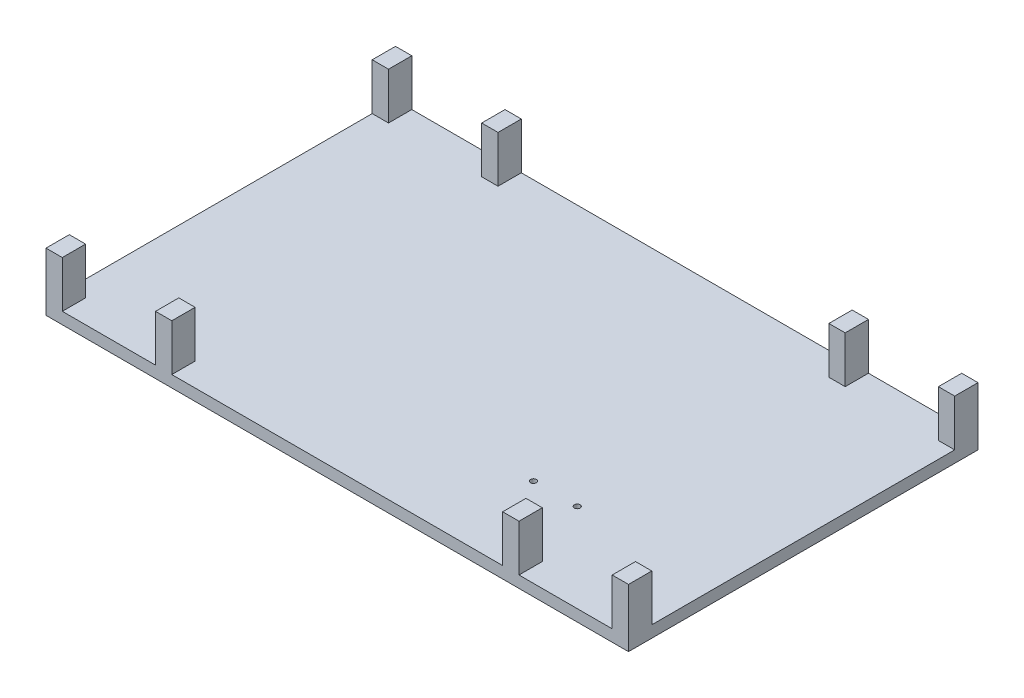
from build123d import *

# Parameters (mm, degrees)
SKETCH1_W           = 250
SKETCH1_H           = 150
BOSS_EXTRUDE1_DEPTH = 5
SKETCH2_W           = 7
SKETCH2_H           = 10
BOSS_EXTRUDE2_DEPTH = 20
SKETCH3_R           = 1.25
CUT_EXTRUDE1_DEPTH  = 148.139389696


with BuildPart() as part:
    # Sketch1 → Boss-Extrude1 (new body)
    with BuildSketch(Plane(origin=(0, 0, 0), x_dir=(1, 0, 0), z_dir=(0, 1, 0))):
        Rectangle(SKETCH1_W, SKETCH1_H)
    extrude(amount=BOSS_EXTRUDE1_DEPTH)

    # Sketch2 → Boss-Extrude2 (add)
    with BuildSketch(Plane(origin=(0, 5, 0), x_dir=(1, 0, 0), z_dir=(0, 1, 0))):
        with Locations((-121.5, -70)):
            Rectangle(SKETCH2_W, SKETCH2_H)
        with Locations((-74.5, -70)):
            Rectangle(SKETCH2_W, SKETCH2_H)
        with Locations((-121.5, 70)):
            Rectangle(SKETCH2_W, SKETCH2_H)
        with Locations((-74.5, 70)):
            Rectangle(SKETCH2_W, SKETCH2_H)
        with Locations((121.5, 70)):
            Rectangle(SKETCH2_W, SKETCH2_H)
        with Locations((74.5, 70)):
            Rectangle(SKETCH2_W, SKETCH2_H)
        with Locations((121.5, -70)):
            Rectangle(SKETCH2_W, SKETCH2_H)
        with Locations((74.5, -70)):
            Rectangle(SKETCH2_W, SKETCH2_H)
    extrude(amount=BOSS_EXTRUDE2_DEPTH)

    # Sketch3 → Cut-Extrude1 (cut, through all)
    with BuildSketch(Plane(origin=(0, 5, 0), x_dir=(1, 0, 0), z_dir=(0, 1, 0))):
        with Locations(Location((46.2, -37, 0), (0, 0, 270))):
            Circle(SKETCH3_R)
        with Locations(Location((65, -37, 0), (0, 0, 270))):
            Circle(SKETCH3_R)
    extrude(amount=-CUT_EXTRUDE1_DEPTH, mode=Mode.SUBTRACT)


solid = part.part
